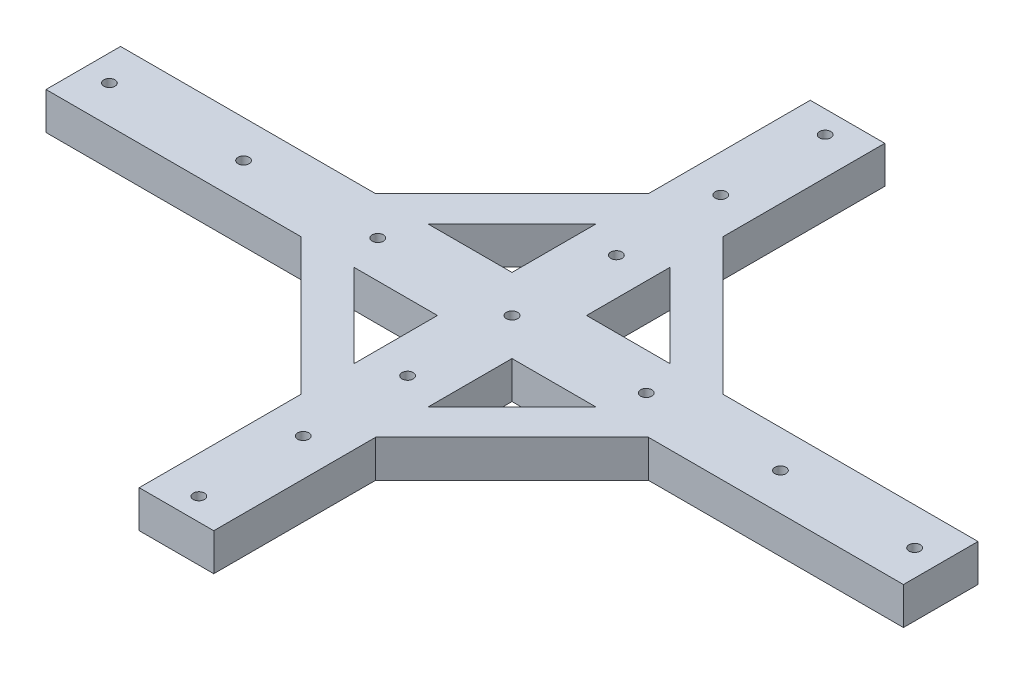
from build123d import *

# Parameters (mm, degrees)
BOSS_EXTRUDE1_DEPTH = 10
BOSS_EXTRUDE2_DEPTH = 10
SKETCH2_R           = 1.5
CUT_EXTRUDE1_DEPTH  = 147.372811683


with BuildPart() as part:
    # Sketch1 → Boss-Extrude1 (new body)
    with BuildSketch(Plane(origin=(0, 0, 0), x_dir=(1, 0, 0), z_dir=(0, 1, 0))):
        Polygon((-115, -10), (-10, -10), (-10, -90), (10, -90), (10, -10), (115, -10), (115, 10), (10, 10), (10, 90), (-10, 90), (-10, 10), (-115, 10), align=None)
    extrude(amount=BOSS_EXTRUDE1_DEPTH)

    # Sketch3 → Boss-Extrude2 (add)
    with BuildSketch(Plane(origin=(0, 0, 0), x_dir=(1, 0, 0), z_dir=(0, 1, 0))):
        Polygon((0, -56.568542495), (56.568542495, 0), (0, 56.568542495), (-56.568542495, 0), align=None)
        Polygon((0, -42.426406871), (42.426406871, 0), (0, 42.426406871), (-42.426406871, 0), align=None, mode=Mode.SUBTRACT)
    extrude(amount=BOSS_EXTRUDE2_DEPTH)

    # Sketch2 → Cut-Extrude1 (cut, through all)
    with BuildSketch(Plane(origin=(0, 10, 0), x_dir=(1, 0, 0), z_dir=(0, 1, 0))):
        with Locations(Location((0, 0, 0), (0, 0, 270))):
            Circle(SKETCH2_R)
        with Locations(Location((36, 0, 0), (0, 0, 270))):
            Circle(SKETCH2_R)
        with Locations(Location((72, 0, 0), (0, 0, 270))):
            Circle(SKETCH2_R)
        with Locations(Location((108, 0, 0), (0, 0, 270))):
            Circle(SKETCH2_R)
        with Locations(Location((0, 28, 0), (0, 0, 270))):
            Circle(SKETCH2_R)
        with Locations(Location((-36, 0, 0), (0, 0, 270))):
            Circle(SKETCH2_R)
        with Locations(Location((-72, 0, 0), (0, 0, 270))):
            Circle(SKETCH2_R)
        with Locations(Location((-108, 0, 0), (0, 0, 270))):
            Circle(SKETCH2_R)
        with Locations(Location((0, 56, 0), (0, 0, 270))):
            Circle(SKETCH2_R)
        with Locations(Location((0, 84, 0), (0, 0, 270))):
            Circle(SKETCH2_R)
        with Locations(Location((0, -28, 0), (0, 0, 270))):
            Circle(SKETCH2_R)
        with Locations(Location((0, -56, 0), (0, 0, 270))):
            Circle(SKETCH2_R)
        with Locations(Location((0, -84, 0), (0, 0, 270))):
            Circle(SKETCH2_R)
    extrude(amount=-CUT_EXTRUDE1_DEPTH, mode=Mode.SUBTRACT)


solid = part.part
